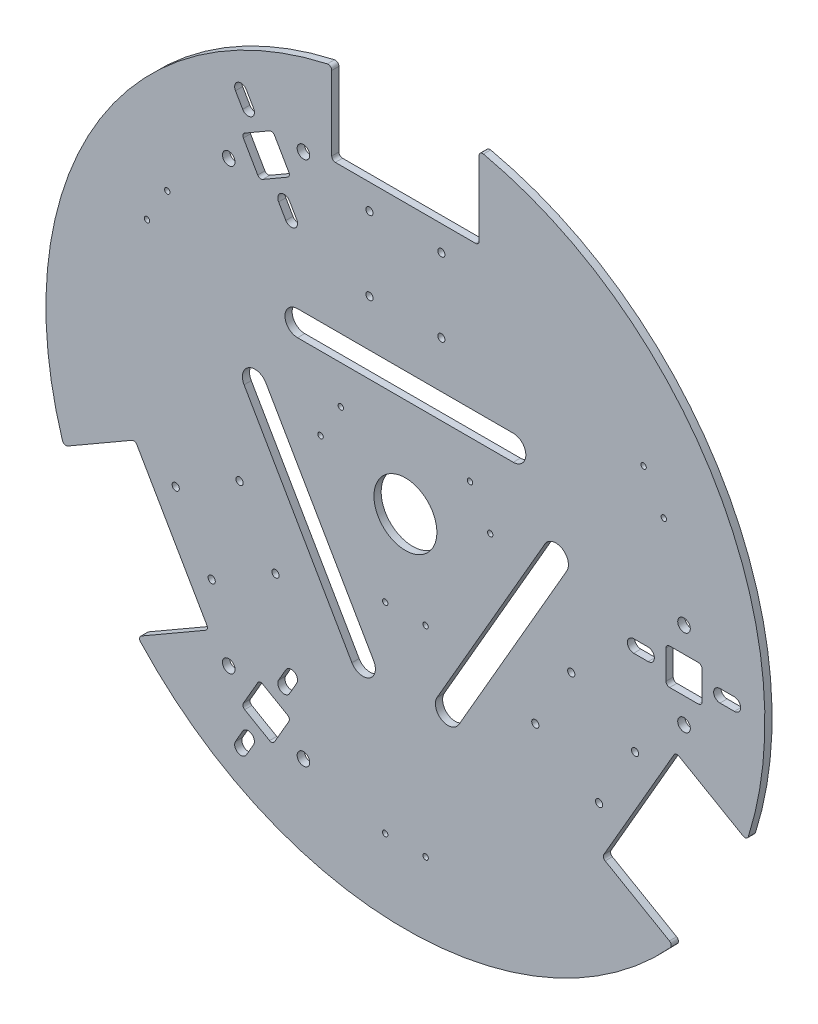
from build123d import *

# Parameters (mm, degrees)
SKETCH1_R           = 200
BOSS_EXTRUDE2_DEPTH = 4
CUT_EXTRUDE3_DEPTH  = 4
SKETCH4_R           = 17.500000000000004
CUT_EXTRUDE4_DEPTH  = 4
SKETCH5_R           = 2
CUT_EXTRUDE5_DEPTH  = 4
SKETCH6_R           = 1.4999999999999973
SKETCH6_R_2         = 1.5000000000000042
CUT_EXTRUDE6_DEPTH  = 4
CIRPATTERN2_COUNT   = 3
CIRPATTERN3_COUNT   = 3
CUT_EXTRUDE7_DEPTH  = 4
CIRPATTERN4_COUNT   = 3
SKETCH9_R           = 3.500000000000001
SKETCH9_R_2         = 3.5000000000000075
CUT_EXTRUDE8_DEPTH  = 4
CIRPATTERN5_COUNT   = 3
CIRPATTERN6_COUNT   = 3
FILLET1_R           = 2
FILLET2_R           = 2


with BuildPart() as part:
    # Sketch1 → Boss-Extrude2 (new body)
    with BuildSketch(Plane.XY):
        Circle(SKETCH1_R)
    extrude(amount=BOSS_EXTRUDE2_DEPTH)

    # Sketch3 → Cut-Extrude3 (cut)
    with BuildSketch(Plane.XY):
        with BuildLine():
            Line((-41.00000000000001, 195.75239462136855), (-41, 150.00000000000003))
            Line((-41, 150.00000000000003), (41, 150.00000000000003))
            Line((41, 150.00000000000003), (41.00000000000001, 195.75239462136855))
            ThreePointArc((41.00000000000001, 195.75239462136855), (1.225e-14, 200), (-41.00000000000001, 195.75239462136855))
        make_face()
    cut_extrude3 = extrude(amount=CUT_EXTRUDE3_DEPTH, mode=Mode.SUBTRACT)

    # Sketch4 → Cut-Extrude4 (cut)
    with BuildSketch(Plane.XY):
        with Locations(Location((0, 0, 0), (0, 0, 180))):
            Circle(SKETCH4_R)
    extrude(amount=CUT_EXTRUDE4_DEPTH, mode=Mode.SUBTRACT)

    # Sketch5 → Cut-Extrude5 (cut)
    with BuildSketch(Plane.XY):
        with Locations(Location((-20, 136, 0), (0, 0, 180))):
            Circle(SKETCH5_R)
        with Locations(Location((-20, 95, 0), (0, 0, 180))):
            Circle(SKETCH5_R)
        with Locations(Location((20, 136, 0), (0, 0, 180))):
            Circle(SKETCH5_R)
        with Locations(Location((20, 95, 0), (0, 0, 180))):
            Circle(SKETCH5_R)
    cut_extrude5 = extrude(amount=CUT_EXTRUDE5_DEPTH, mode=Mode.SUBTRACT)

    # Sketch6 → Cut-Extrude6 (cut)
    with BuildSketch(Plane.XY):
        with Locations((-143.75605190361796, 70.00721420742511)):
            Circle(SKETCH6_R)
        with Locations((-132.50605190361796, 89.49278579257494)):
            Circle(SKETCH6_R)
        with Locations((-35.94421938165304, 33.742785792574935)):
            Circle(SKETCH6_R_2)
        with Locations((-47.19421938165304, 14.257214207425067)):
            Circle(SKETCH6_R_2)
    cut_extrude6 = extrude(amount=CUT_EXTRUDE6_DEPTH, mode=Mode.SUBTRACT)

    # CirPattern2: Cut-Extrude6 ×3 about axis
    cirpattern2_axis = Axis((9.38e-15, 1.23e-15, 0), (0, 0, 1))
    for i in range(1, CIRPATTERN2_COUNT):
        add(cut_extrude6.rotate(cirpattern2_axis, i * 360 / CIRPATTERN2_COUNT), mode=Mode.SUBTRACT)

    # CirPattern3: Cut-Extrude5 ×3 about axis
    cirpattern3_axis = Axis((6.55e-15, -6.68e-15, 0), (0, 0, 1))
    for i in range(1, CIRPATTERN3_COUNT):
        add(cut_extrude5.rotate(cirpattern3_axis, i * 360 / CIRPATTERN3_COUNT), mode=Mode.SUBTRACT)

    # Sketch8 → Cut-Extrude7 (cut)
    with BuildSketch(Plane.XY):
        with BuildLine():
            Line((-60, 69), (60, 69.00000000000003))
            ThreePointArc((60, 69.00000000000003), (66.99999999999997, 62), (60, 55.00000000000002))
            Line((60, 55.00000000000002), (-60, 55))
            ThreePointArc((-60, 55), (-67, 62), (-60, 69))
        make_face()
    cut_extrude7 = extrude(amount=CUT_EXTRUDE7_DEPTH, mode=Mode.SUBTRACT)

    # CirPattern4: Cut-Extrude7 ×3 about axis
    cirpattern4_axis = Axis((2.08e-15, -4.82e-15, 0), (0, 0, 1))
    for i in range(1, CIRPATTERN4_COUNT):
        add(cut_extrude7.rotate(cirpattern4_axis, i * 360 / CIRPATTERN4_COUNT), mode=Mode.SUBTRACT)

    # Sketch9 → Cut-Extrude8 (cut)
    with BuildSketch(Plane.XY.offset(4)):
        with Locations((-56.71539030917355, 146.233937586588)):
            Circle(SKETCH9_R)
        with Locations((-98.28460969082658, 122.23393758658793)):
            Circle(SKETCH9_R_2)
        Polygon((-91.16025403784447, 137.89419162443235), (-81.16025403784445, 120.57368354874356), (-63.83974596215569, 130.57368354874362), (-73.8397459621557, 147.89419162443235), align=None)
        with BuildLine():
            Line((-64.46891108675452, 118.66342951089922), (-60.46891108675456, 111.73522628062365))
            ThreePointArc((-60.46891108675456, 111.73522628062365), (-61.75000000000001, 106.9541373673781), (-66.53108891324563, 108.23522628062368))
            Line((-66.53108891324563, 108.23522628062368), (-70.53108891324557, 115.1634295108992))
            ThreePointArc((-70.53108891324557, 115.1634295108992), (-69.25000000000003, 119.94451842414472), (-64.46891108675452, 118.66342951089922))
        make_face()
        with BuildLine():
            Line((-84.46891108675456, 153.30444566227675), (-88.46891108675459, 160.23264889255222))
            ThreePointArc((-88.46891108675459, 160.23264889255222), (-93.25000000000009, 161.5137378057978), (-94.53108891324563, 156.73264889255222))
            Line((-94.53108891324563, 156.73264889255222), (-90.53108891324563, 149.80444566227675))
            ThreePointArc((-90.53108891324563, 149.80444566227675), (-85.7500000000001, 148.52335674903122), (-84.46891108675456, 153.30444566227675))
        make_face()
    cut_extrude8 = extrude(amount=-CUT_EXTRUDE8_DEPTH, mode=Mode.SUBTRACT)

    # CirPattern5: Cut-Extrude8 ×3 about axis
    cirpattern5_axis = Axis((6.83e-15, -3.41e-15, 0), (0, 0, 1))
    for i in range(1, CIRPATTERN5_COUNT):
        add(cut_extrude8.rotate(cirpattern5_axis, i * 360 / CIRPATTERN5_COUNT), mode=Mode.SUBTRACT)

    # CirPattern6: Cut-Extrude3 ×3 about axis
    cirpattern6_axis = Axis((-9.9e-16, -1.19e-14, 0), (0, 0, 1))
    for i in range(1, CIRPATTERN6_COUNT):
        add(cut_extrude3.rotate(cirpattern6_axis, i * 360 / CIRPATTERN6_COUNT), mode=Mode.SUBTRACT)

    # Fillet1
    fillet1_edges = [part.edges().sort_by_distance(p)[0] for p in [
        (41.00000000000001, 195.75239462136855, 2),
        (-41.00000000000001, 195.75239462136855, 2),
        (-41, 150.00000000000003, 2),
        (41, 150.00000000000003, 2),
        (149.0265465937414, -133.38323886584638, 2),
        (190.02654659374144, -62.36915575552241, 2),
        (150.4038105676658, -39.49295844483813, 2),
        (109.40381056766577, -110.50704155516208, 2),
        (-190.0265465937415, -62.36915575552226, 2),
        (-149.0265465937415, -133.38323886584627, 2),
        (-109.40381056766586, -110.50704155516199, 2),
        (-150.40381056766583, -39.49295844483801, 2),
    ]]
    fillet(fillet1_edges, radius=FILLET1_R)

    # Fillet2
    fillet2_edges = [part.edges().sort_by_distance(p)[0] for p in [
        (-91.16025403784447, 137.89419162443235, 2),
        (-73.8397459621557, 147.89419162443235, 2),
        (-63.83974596215569, 130.57368354874362, 2),
        (-81.16025403784445, 120.57368354874356, 2),
        (-73.83974596215556, -147.8941916244324, 2),
        (-91.16025403784433, -137.8941916244324, 2),
        (-81.16025403784437, -120.57368354874366, 2),
        (-63.83974596215556, -130.57368354874362, 2),
        (165.00000000000003, 10, 2),
        (165, -10, 2),
        (145.00000000000006, -10.000000000000014, 2),
        (145, 10, 2),
    ]]
    fillet(fillet2_edges, radius=FILLET2_R)


solid = part.part
